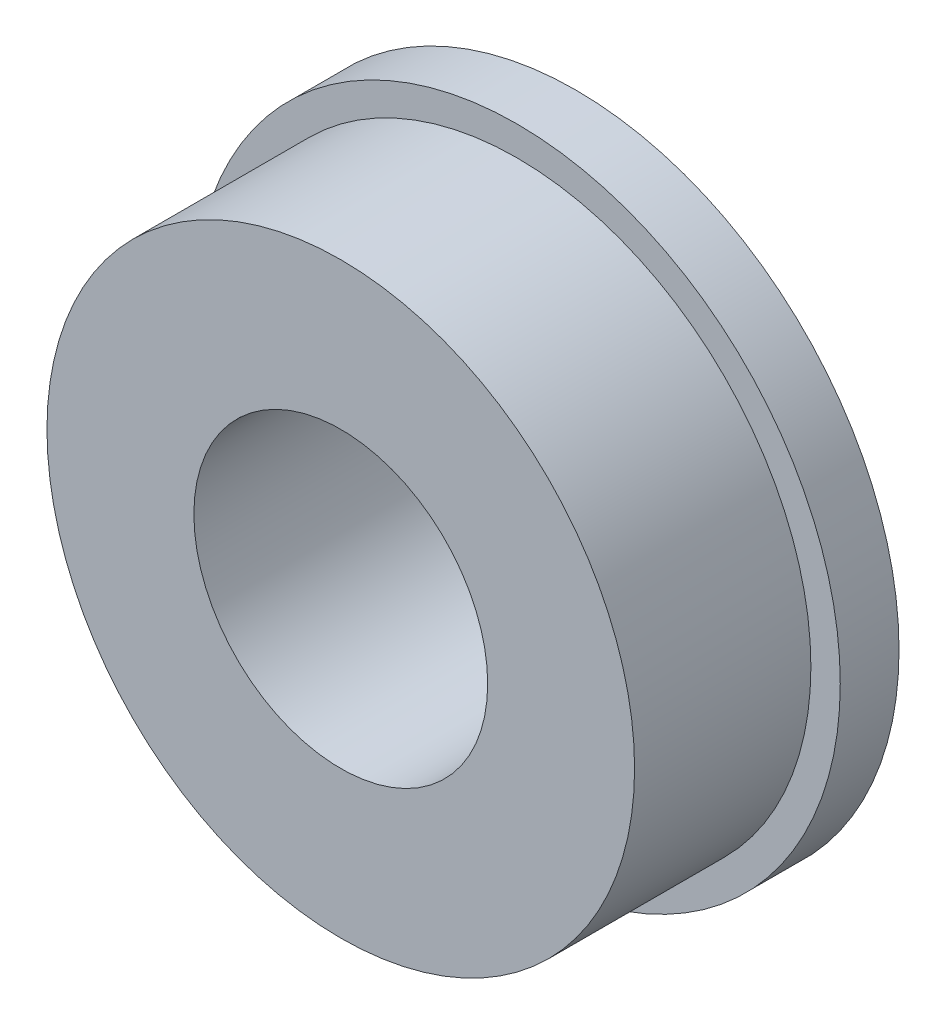
from build123d import *
from build123d.topology import SkipClean

# Parameters (mm, degrees)
SKETCH_1_R      = 5
SKETCH_1_R_2    = 2.5
EXTRUDE_1_DEPTH = 3
EXTRUDE_START   = 1
SKETCH_2_R      = 5.5
SKETCH_2_R_2    = 2.5
EXTRUDE_2_DEPTH = 1


with BuildPart() as part:
    # 草图1 → 凸台-拉伸1 (new body)
    with BuildSketch(Plane.XY):
        Circle(SKETCH_1_R)
        Circle(SKETCH_1_R_2, mode=Mode.SUBTRACT)
    extrude(amount=EXTRUDE_1_DEPTH)

    # 草图2 → 凸台-拉伸2 (add)
    with SkipClean():  # the faces are left unmerged after this step: merging them gives an invalid solid
        with BuildSketch(Plane(origin=(0, 0, 0), x_dir=(-1, 0, 0), z_dir=(0, 0, -1)).offset(EXTRUDE_START)):
            Circle(SKETCH_2_R)
            Circle(SKETCH_2_R_2, mode=Mode.SUBTRACT)
        extrude(amount=-EXTRUDE_2_DEPTH)


solid = part.part
